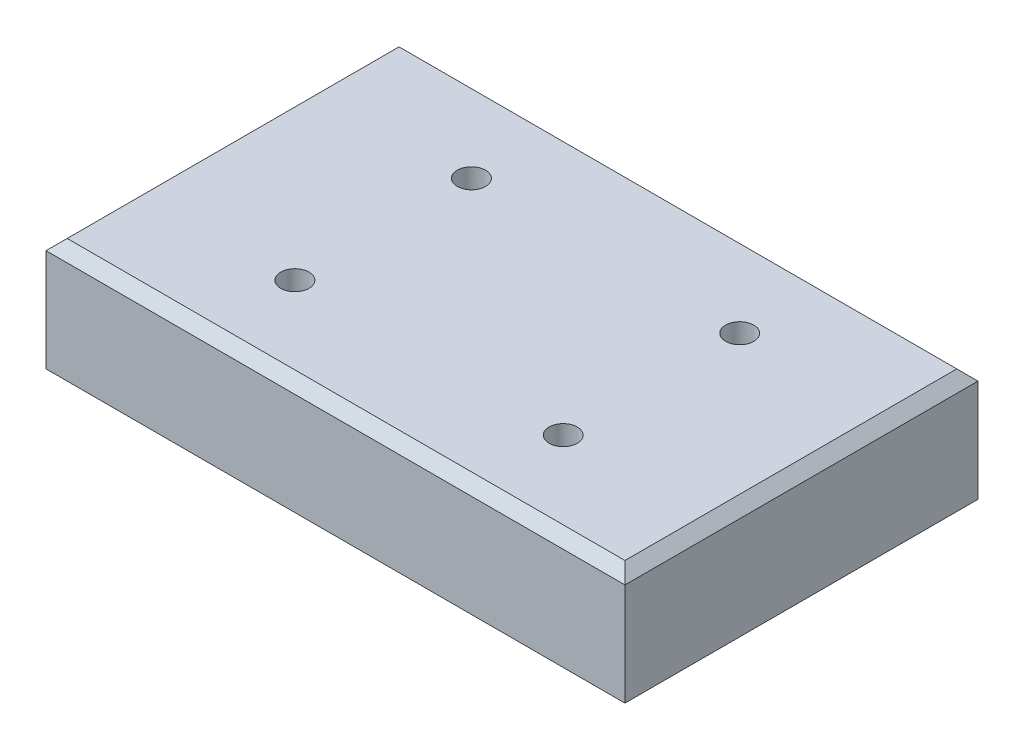
from build123d import *

# Parameters (mm, degrees)
SKETCH1_W                   = 82
SKETCH1_H                   = 50
BOSS_EXTRUDE1_DEPTH         = 16
CHAMFER1_SIZE               = 1.5
M4_TAPPED_HOLE3_D           = 3.3
M4_TAPPED_HOLE3_DEPTH       = 10.1
M4_TAPPED_HOLE3_CBORE_D     = 4
M4_TAPPED_HOLE3_CBORE_DEPTH = 8
M4_TAPPED_HOLE3_TIP         = 0.991420021


with BuildPart() as part:
    # Sketch1 → Boss-Extrude1 (new body)
    with BuildSketch(Plane(origin=(0, 0, 0), x_dir=(1, 0, 0), z_dir=(0, 1, 0))):
        Rectangle(SKETCH1_W, SKETCH1_H)
    extrude(amount=BOSS_EXTRUDE1_DEPTH)

    # Chamfer1
    chamfer1_edges = [part.edges().sort_by_distance(p)[0] for p in [
        (41, 16, 0),
        (0, 16, -25),
        (-41, 16, 0),
        (0, 16, 25),
    ]]
    chamfer(chamfer1_edges, length=CHAMFER1_SIZE)

    # M4 Tapped Hole3
    with Locations(Plane(origin=(0, 16, 0), x_dir=(1, 0, 0), z_dir=(0, 1, 0))):
        with Locations((-18.25, -12.5), (19.75, 12.5), (-18.25, 12.5), (19.75, -12.5)):
            CounterBoreHole(M4_TAPPED_HOLE3_D / 2, M4_TAPPED_HOLE3_CBORE_D / 2, M4_TAPPED_HOLE3_CBORE_DEPTH, depth=M4_TAPPED_HOLE3_DEPTH)
            with Locations((0, 0, -(M4_TAPPED_HOLE3_DEPTH + M4_TAPPED_HOLE3_TIP / 2))):  # 118° drill point
                Cone(0, M4_TAPPED_HOLE3_D / 2, M4_TAPPED_HOLE3_TIP, mode=Mode.SUBTRACT)


solid = part.part
